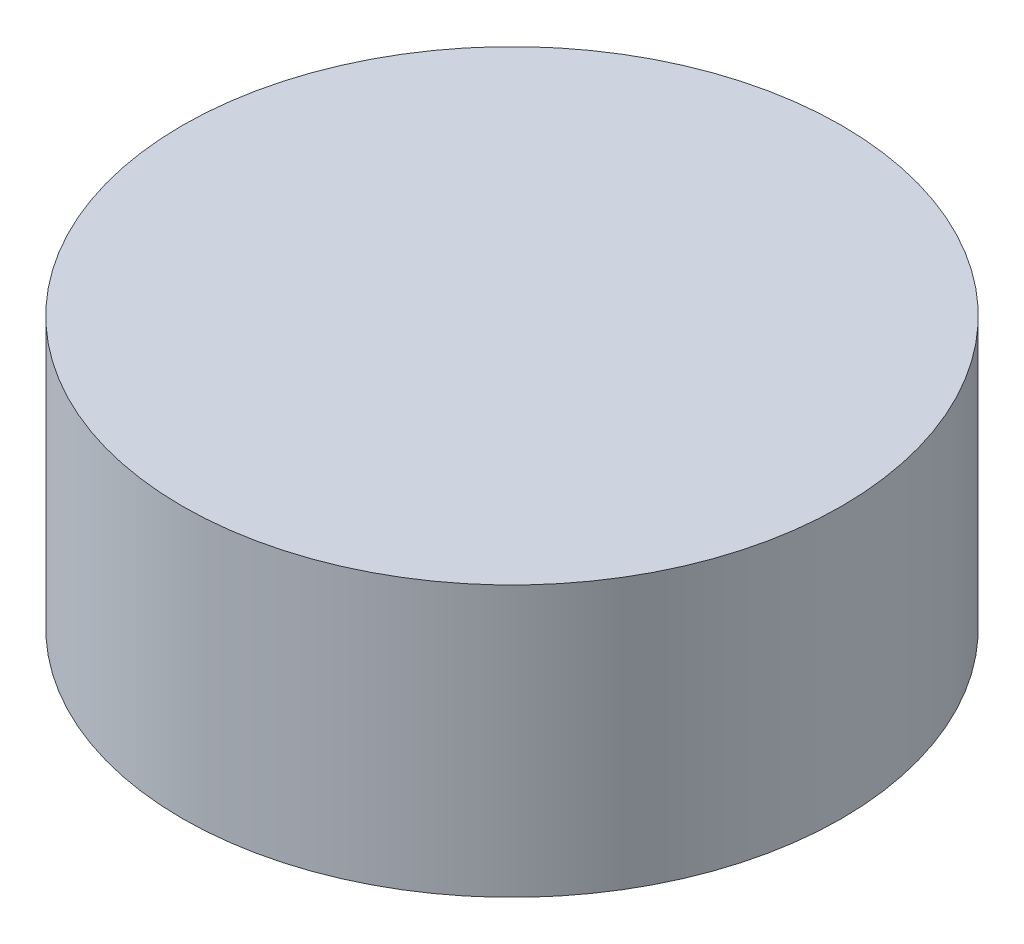
from build123d import *

# Parameters (mm, degrees)
SKETCH1_R           = 3.9
BOSS_EXTRUDE1_DEPTH = 3.2
SHELL1_T            = -1.3


with BuildPart() as part:
    # Sketch1 → Boss-Extrude1 (new body)
    with BuildSketch(Plane(origin=(0, 0, 0), x_dir=(1, 0, 0), z_dir=(0, 1, 0))):
        with Locations(Location((3.9, 3.9, 0), (0, 0, 270))):
            Circle(SKETCH1_R)
    extrude(amount=-BOSS_EXTRUDE1_DEPTH)

    # Shell1
    shell1_openings = [part.faces().sort_by_distance(p)[0] for p in [
        (3.9, -3.2, -3.9),
    ]]
    offset(amount=SHELL1_T, openings=shell1_openings, kind=Kind.INTERSECTION)


solid = part.part
